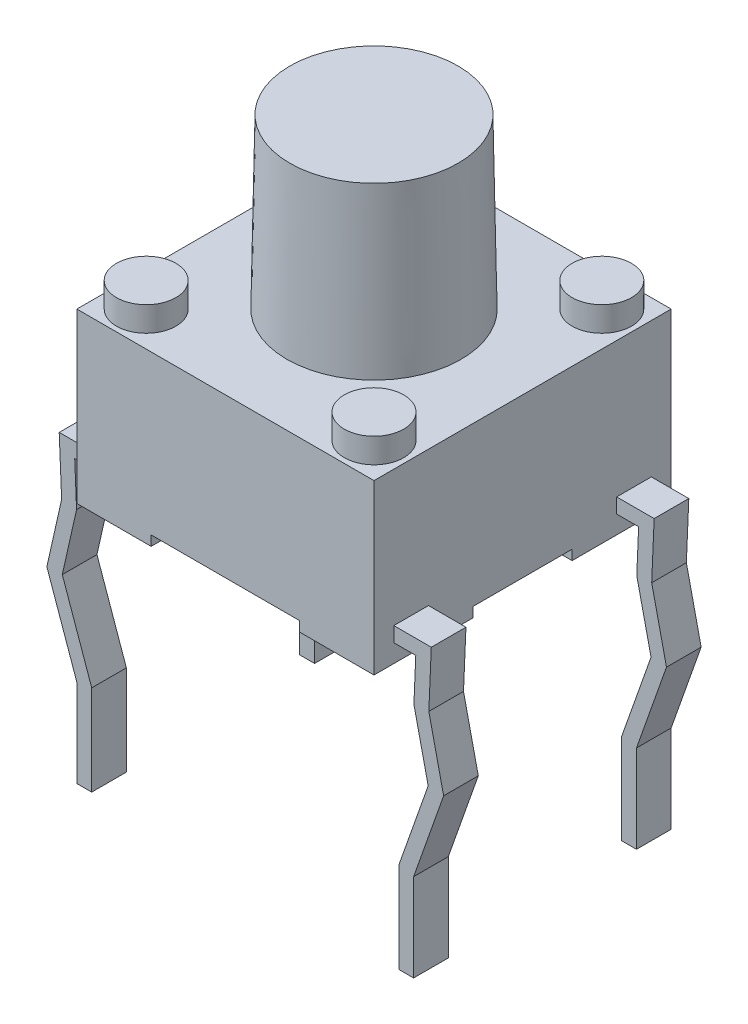
from build123d import *

# Parameters (mm, degrees)
IZIM1_W                     = 6
IZIM1_H                     = 6
Y_KSEKLIK_EKSTR_ZYON1_DEPTH = 3.3
IZIM2_W                     = 6
IZIM2_H                     = 6
Y_KSEKLIK_EKSTR_ZYON2_DEPTH = 0.1
IZIM3_W                     = 3
IZIM3_H                     = 0.2
KES_EKSTR_ZYON1_DEPTH       = 1.5
IZIM4_W                     = 2
IZIM4_H                     = 0.2
KES_EKSTR_ZYON2_DEPTH       = 8.475961477
IZIM5_R                     = 1.7
Y_KSEKLIK_EKSTR_ZYON3_DEPTH = 3.4
DRAFT4_ANGLE                = 1
IZIM6_R                     = 0.6
Y_KSEKLIK_EKSTR_ZYON4_DEPTH = 0.5
Y_KSEKLIK_EKSTR_ZYON5_DEPTH = 0.35
L_O_ALTMA1_COUNT            = 2
L_O_ALTMA1_PITCH            = 4.5


with BuildPart() as part:
    # Çizim1 → Yükseklik-Ekstrüzyon1 (new body)
    with BuildSketch(Plane(origin=(0, 0, 0), x_dir=(1, 0, 0), z_dir=(0, 1, 0))):
        Rectangle(IZIM1_W, IZIM1_H)
    extrude(amount=-Y_KSEKLIK_EKSTR_ZYON1_DEPTH)

    # Çizim2 → Yükseklik-Ekstrüzyon2 (add)
    with BuildSketch(Plane(origin=(0, 0, 0), x_dir=(1, 0, 0), z_dir=(0, 1, 0))):
        Rectangle(IZIM2_W, IZIM2_H)
    extrude(amount=Y_KSEKLIK_EKSTR_ZYON2_DEPTH)

    # Çizim3 → Kes-Ekstrüzyon1 (cut)
    with BuildSketch(Plane.XY.offset(3)):
        with Locations((0, -3.2)):
            Rectangle(IZIM3_W, IZIM3_H)
    kes_ekstr_zyon1 = extrude(amount=-KES_EKSTR_ZYON1_DEPTH, mode=Mode.SUBTRACT)

    # Aynalama1: Kes-Ekstrüzyon1 across plane
    add(kes_ekstr_zyon1.mirror(Plane.XY), mode=Mode.SUBTRACT)

    # Çizim4 → Kes-Ekstrüzyon2 (cut, through all)
    with BuildSketch(Plane.ZY.offset(3)):
        with Locations((0, -3.2)):
            Rectangle(IZIM4_W, IZIM4_H)
    extrude(amount=-KES_EKSTR_ZYON2_DEPTH, mode=Mode.SUBTRACT)

    # Çizim5 → Yükseklik-Ekstrüzyon3 (add)
    with BuildSketch(Plane(origin=(0, 0.1, 0), x_dir=(1, 0, 0), z_dir=(0, 1, 0))):
        with Locations(Location((0, 0, 0), (0, 0, 270))):
            Circle(IZIM5_R)
    extrude(amount=Y_KSEKLIK_EKSTR_ZYON3_DEPTH)

    # Draft4
    draft4_faces = [part.faces().sort_by_distance(p)[0] for p in [
        (0, 1.8, -1.7),
    ]]
    draft(draft4_faces, Plane.ZX.offset(3.5), DRAFT4_ANGLE)

    # Çizim6 → Yükseklik-Ekstrüzyon4 (add)
    with BuildSketch(Plane(origin=(0, 0.1, 0), x_dir=(1, 0, 0), z_dir=(0, 1, 0))):
        with Locations(Location((-2.3, 2.3, 0), (0, 0, 270))):
            Circle(IZIM6_R)
        with Locations(Location((2.3, 2.3, 0), (0, 0, 90))):
            Circle(IZIM6_R)
        with Locations(Location((2.3, -2.3, 0), (0, 0, 270))):
            Circle(IZIM6_R)
        with Locations(Location((-2.3, -2.3, 0), (0, 0, 90))):
            Circle(IZIM6_R)
    extrude(amount=Y_KSEKLIK_EKSTR_ZYON4_DEPTH)

    # Çizim8 → Yükseklik-Ekstrüzyon5 (add, symmetric)
    with BuildSketch(Plane.XY.offset(2.25)):
        Polygon((-3, -2.63511714), (-3.756588195, -2.63511714), (-3.70725074, -3.782570711), (-4.005822093, -5.10919798), (-3.4, -6.825693909), (-3.4, -8.597874756), (-3.1, -8.597874756), (-3.1, -6.774306091), (-3.694177907, -5.09080202), (-3.405814351, -3.809530548), (-3.443411805, -2.93511714), (-3, -2.93511714), align=None)
        Polygon((3, -2.93511714), (3.443411805, -2.93511714), (3.405814351, -3.809530548), (3.694177907, -5.09080202), (3.1, -6.774306091), (3.1, -8.597874756), (3.4, -8.597874756), (3.4, -6.825693909), (4.005822093, -5.10919798), (3.70725074, -3.782570711), (3.756588195, -2.63511714), (3, -2.63511714), align=None)
    y_kseklik_ekstr_zyon5 = extrude(amount=Y_KSEKLIK_EKSTR_ZYON5_DEPTH, both=True)

    # LÇoğaltma1: Yükseklik-Ekstrüzyon5 ×2
    with Locations(*[(0, 0, -i * L_O_ALTMA1_PITCH) for i in range(1, L_O_ALTMA1_COUNT)]):
        add(y_kseklik_ekstr_zyon5)


solid = part.part
